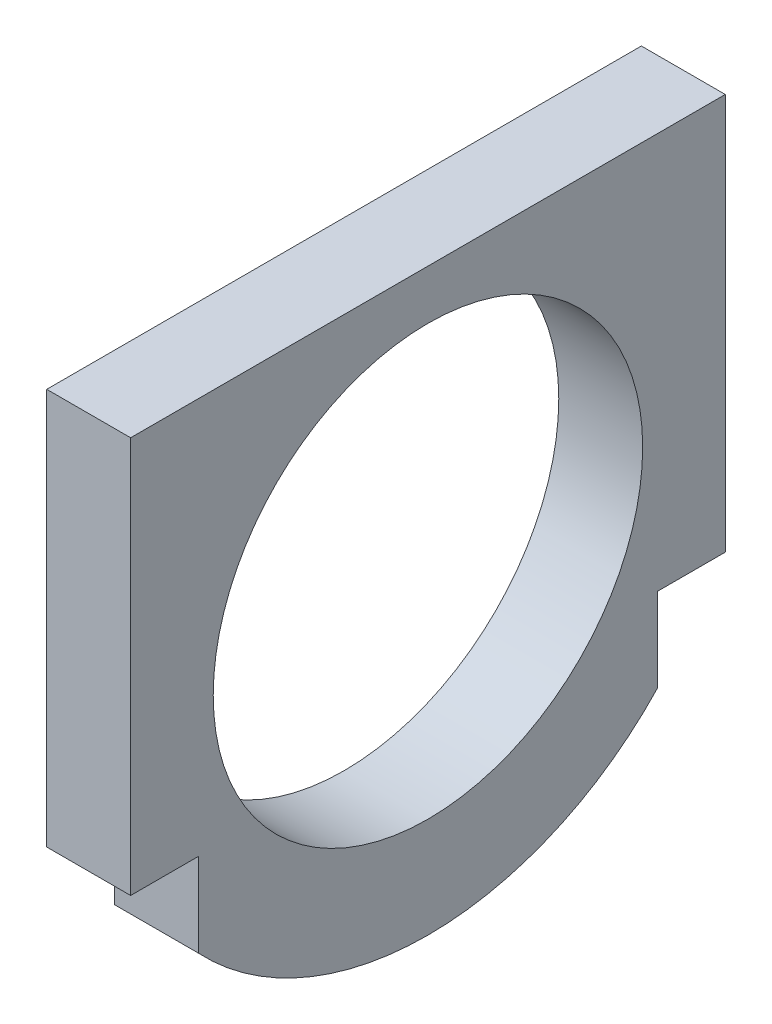
from build123d import *

# Parameters (mm, degrees)
SKETCH1_R  = 6.5
BASE_DEPTH = 2.54


with BuildPart() as part:
    # Sketch1 → Base (new body)
    with BuildSketch(Plane(origin=(0, 0, 0), x_dir=(0, 0, -1), z_dir=(1, 0, 0))):
        with BuildLine():
            Line((9, -4), (9, 8))
            Line((9, 8), (-9, 8))
            Line((-9, 8), (-9, -4))
            Line((-9, -4), (-6.945502142, -4))
            Line((-6.945502142, -4), (-6.945502142, -6.54))
            ThreePointArc((-6.945502142, -6.54), (0, -9.54), (6.945502142, -6.54))
            Line((6.945502142, -6.54), (6.945502142, -4))
            Line((6.945502142, -4), (9, -4))
        make_face()
        Circle(SKETCH1_R, mode=Mode.SUBTRACT)
    extrude(amount=BASE_DEPTH)


solid = part.part
